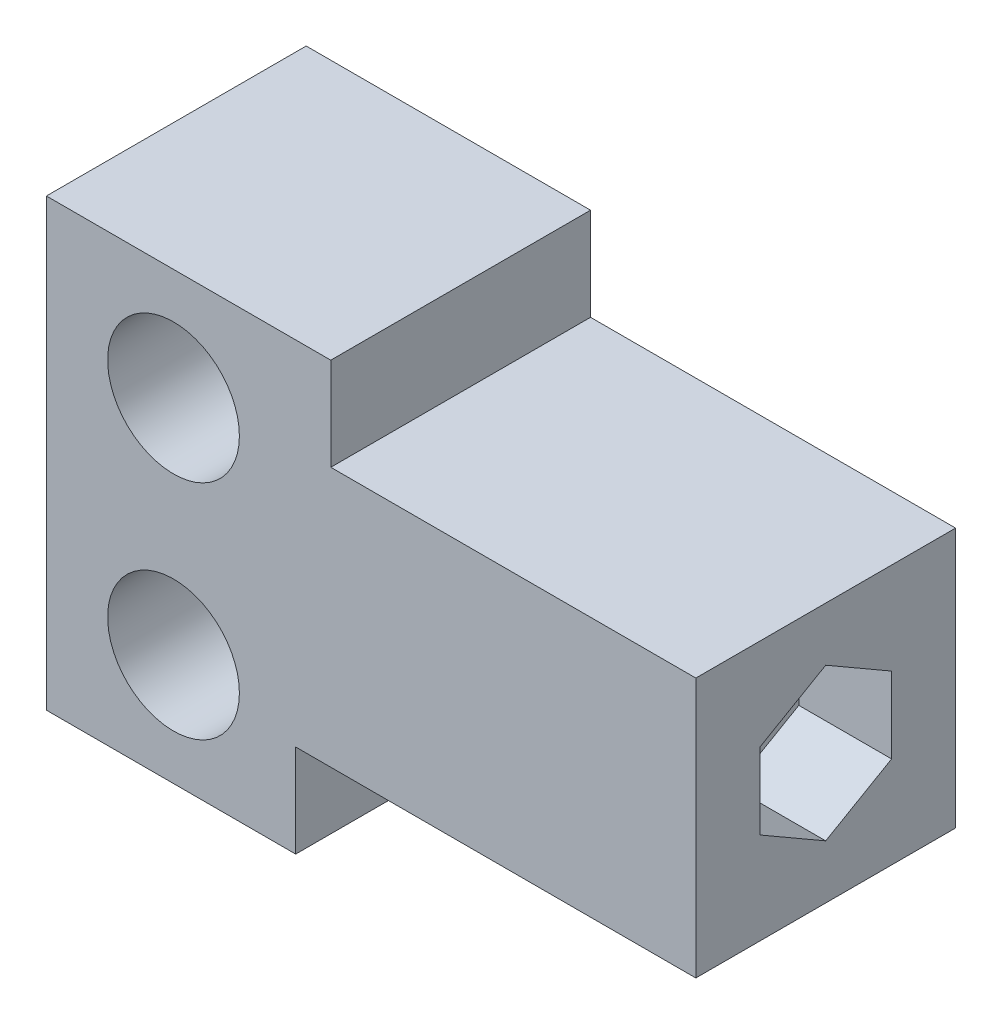
from build123d import *

# Parameters (mm, degrees)
ESQUISSE1_W             = 14
ESQUISSE1_H             = 14
BOSS_EXTRU_1_DEPTH      = 35
ESQUISSE2_R             = 2
ENL_V_MAT_EXTRU_1_DEPTH = 37.373066959
ENL_V_MAT_EXTRU_2_DEPTH = 5
ESQUISSE4_W             = 15.325652572
ESQUISSE4_H             = 14
BOSS_EXTRU_2_DEPTH      = 5
ESQUISSE5_W             = 13.435346111
ESQUISSE5_H             = 14
BOSS_EXTRU_3_DEPTH      = 5
ESQUISSE6_R             = 1.5
ENL_V_MAT_EXTRU_3_DEPTH = 40.56008089
ESQUISSE7_R             = 3.55
ENL_V_MAT_EXTRU_4_DEPTH = 8


with BuildPart() as part:
    # Esquisse1 → Boss.-Extru.1 (new body)
    with BuildSketch(Plane(origin=(0, 0, 0), x_dir=(0, 0, -1), z_dir=(1, 0, 0))):
        Rectangle(ESQUISSE1_W, ESQUISSE1_H)
    extrude(amount=BOSS_EXTRU_1_DEPTH)

    # Esquisse2 → Enlèv. mat.-Extru.1 (cut, through all)
    with BuildSketch(Plane.ZY):
        Circle(ESQUISSE2_R)
    extrude(amount=-ENL_V_MAT_EXTRU_1_DEPTH, mode=Mode.SUBTRACT)

    # Esquisse3 → Enlèv. mat.-Extru.2 (cut)
    with BuildSketch(Plane(origin=(35, 0, 0), x_dir=(0, 0, -1), z_dir=(1, 0, 0))):
        Polygon((3.55, -2.049593456), (3.55, 2.049593456), (0, 4.099186911), (-3.55, 2.049593456), (-3.55, -2.049593456), (0, -4.099186911), align=None)
    extrude(amount=-ENL_V_MAT_EXTRU_2_DEPTH, mode=Mode.SUBTRACT)

    # Esquisse4 → Boss.-Extru.2 (add)
    with BuildSketch(Plane(origin=(0, 7, 0), x_dir=(1, 0, 0), z_dir=(0, 1, 0))):
        with Locations((7.662826286, 0)):
            Rectangle(ESQUISSE4_W, ESQUISSE4_H)
    extrude(amount=BOSS_EXTRU_2_DEPTH)

    # Esquisse5 → Boss.-Extru.3 (add)
    with BuildSketch(Plane.XZ.offset(7)):
        with Locations((6.717673056, 0)):
            Rectangle(ESQUISSE5_W, ESQUISSE5_H)
    extrude(amount=BOSS_EXTRU_3_DEPTH)

    # Esquisse6 → Enlèv. mat.-Extru.3 (cut, through all)
    with BuildSketch(Plane.XY.offset(7)):
        with Locations((6.850460042, 6)):
            Circle(ESQUISSE6_R)
        with Locations((6.850460042, -6)):
            Circle(ESQUISSE6_R)
    extrude(amount=-ENL_V_MAT_EXTRU_3_DEPTH, mode=Mode.SUBTRACT)

    # Esquisse7 → Enlèv. mat.-Extru.4 (cut)
    with BuildSketch(Plane.XY.offset(7)):
        with Locations((6.850460042, 6)):
            Circle(ESQUISSE7_R)
        with Locations((6.850460042, -6)):
            Circle(ESQUISSE7_R)
    extrude(amount=-ENL_V_MAT_EXTRU_4_DEPTH, mode=Mode.SUBTRACT)


solid = part.part
